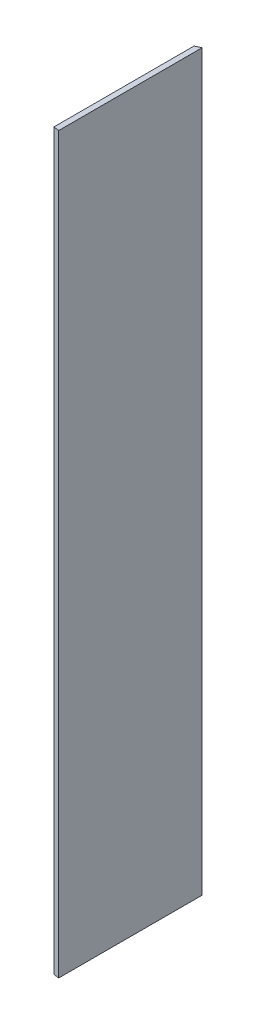
from build123d import *

# Parameters (mm, degrees)
EXTRUDE_1_DEPTH = 533


with BuildPart() as part:
    # Эскиз1 → Вытянуть1 (new body)
    with BuildSketch(Plane(origin=(0, 0, 0), x_dir=(1, 0, 0), z_dir=(0, 1, 0))):
        Polygon((1.026379046, -5.553244715), (1.026379046, -107.324896908), (5.026379046, -107.838799799), (5.026379046, -3.763508183), align=None)
    extrude(amount=EXTRUDE_1_DEPTH)


solid = part.part
